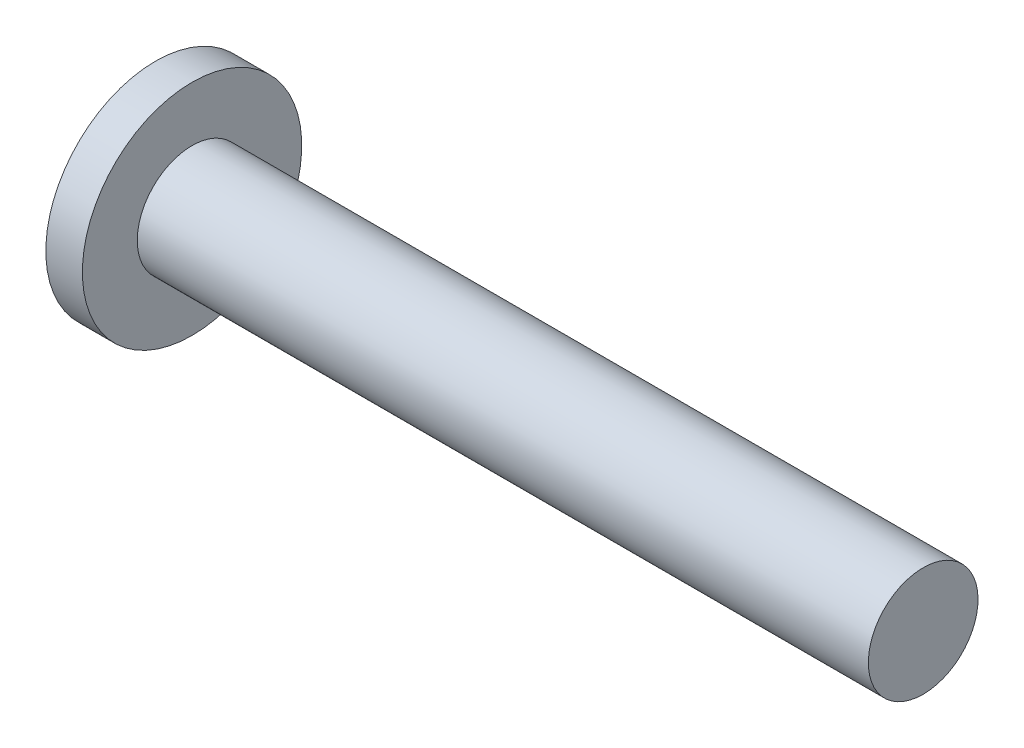
from build123d import *


with BuildPart() as part:
    # 草图1 → 旋转1 (revolve)
    with BuildSketch(Plane.XY, mode=Mode.PRIVATE) as revolve_1_sk:
        Polygon((0, 0), (20, 0), (20, -1.5), (-1, -1.5), (-1, 1.5), (0, 1.5), align=None)
    revolve(revolve_1_sk.sketch.rotate(Axis((-1, -1.5, 0), (1, 0, 0)), 180), axis=Axis((-1, -1.5, 0), (1, 0, 0)))


solid = part.part
